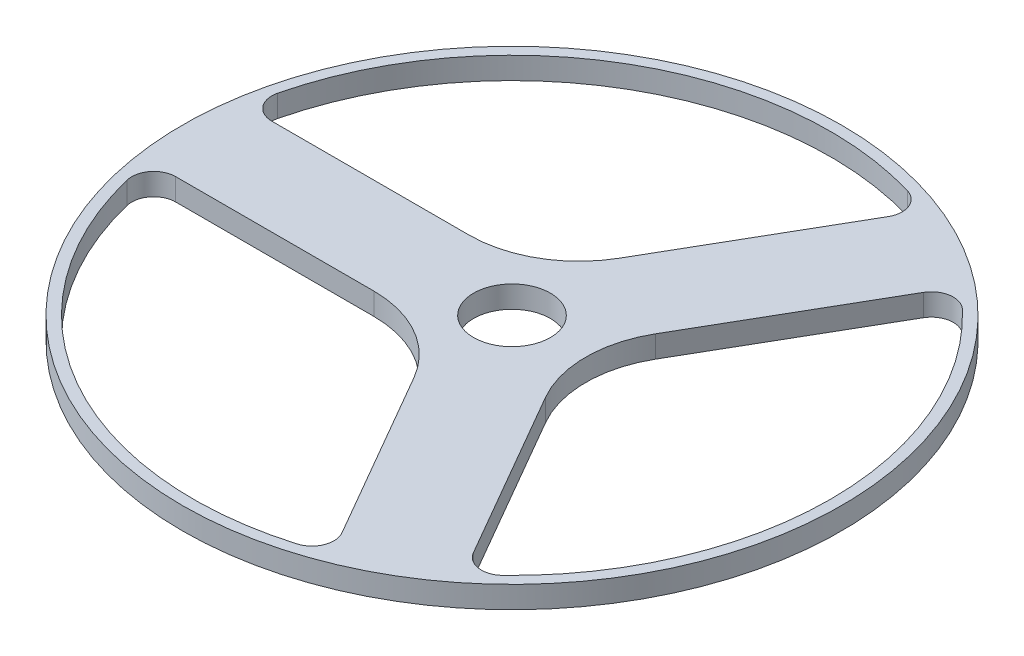
from build123d import *

# Parameters (mm, degrees)
SKETCH1_R           = 46.5
SKETCH1_R_2         = 6.5
SKETCH1_R_3         = 10
SKETCH1_R_4         = 3.5
BOSS_EXTRUDE1_DEPTH = 2
SKETCH3_R           = 5
SKETCH3_R_2         = 3.5
BOSS_EXTRUDE2_DEPTH = 100
SKETCH4_R           = 30
SKETCH4_R_2         = 5
SKETCH4_R_3         = 3.5
BOSS_EXTRUDE5_DEPTH = 2
FILLET2_R           = 2
SKETCH5_R           = 1
SKETCH5_R_2         = 3.5
CUT_EXTRUDE1_DEPTH  = 1
SKETCH6_R           = 2
CUT_EXTRUDE2_DEPTH  = 2
CHAMFER2_SIZE       = 0.8
SKETCH7_R           = 61.085714235
CUT_EXTRUDE3_DEPTH  = 122.361031637


with BuildPart() as part:
    # Sketch1 → Boss-Extrude1 (new body)
    with BuildSketch(Plane(origin=(0, 0, 0), x_dir=(1, 0, 0), z_dir=(0, 1, 0))):
        with Locations(Location((0, 0, 0), (0, 0, 270))):
            Circle(SKETCH1_R)
        with Locations(Location((0, 15, 0), (0, 0, 270))):
            Circle(SKETCH1_R_2, mode=Mode.SUBTRACT)
        with Locations(Location((-12.990381057, -7.5, 0), (0, 0, 270))):
            Circle(SKETCH1_R_3, mode=Mode.SUBTRACT)
        with Locations(Location((12.990381057, -7.5, 0), (0, 0, 270))):
            Circle(SKETCH1_R_4, mode=Mode.SUBTRACT)
        with Locations(Location((0, 0, 0), (0, 0, 270))):
            Circle(SKETCH1_R_4, mode=Mode.SUBTRACT)
    extrude(amount=BOSS_EXTRUDE1_DEPTH)

    # Sketch3 → Boss-Extrude2 (add)
    with BuildSketch(Plane(origin=(0, 2, 0), x_dir=(1, 0, 0), z_dir=(0, 1, 0))):
        with Locations(Location((0, 0, 0), (0, 0, 210))):
            Circle(SKETCH3_R)
        with Locations(Location((0, 0, 0), (0, 0, 270))):
            Circle(SKETCH3_R_2, mode=Mode.SUBTRACT)
    extrude(amount=BOSS_EXTRUDE2_DEPTH)

    # Sketch6 → Cut-Extrude2 (cut)
    with BuildSketch(Plane.XZ):
        with Locations(Location((0, 35, 0), (0, 0, 270))):
            Circle(SKETCH6_R)
        with Locations(Location((27.364101886, 21.822143065, 0), (0, 0, 270))):
            Circle(SKETCH6_R)
        with Locations(Location((34.122476926, -7.788232688, 0), (0, 0, 270))):
            Circle(SKETCH6_R)
        with Locations(Location((15.185930869, -31.533910377, 0), (0, 0, 270))):
            Circle(SKETCH6_R)
        with Locations(Location((-15.185930869, -31.533910377, 0), (0, 0, 270))):
            Circle(SKETCH6_R)
        with Locations(Location((-34.122476926, -7.788232688, 0), (0, 0, 270))):
            Circle(SKETCH6_R)
        with Locations(Location((-27.364101886, 21.822143065, 0), (0, 0, 270))):
            Circle(SKETCH6_R)
    extrude(amount=-CUT_EXTRUDE2_DEPTH, mode=Mode.SUBTRACT)

    # Chamfer2
    chamfer2_edges = [part.edges().sort_by_distance(p)[0] for p in [
        (12.990381057, 0, 4),
        (34.122476926, 0, -5.788232688),
        (27.364101886, 0, 23.822143065),
        (0, 0, 37),
        (-27.364101886, 0, 23.822143065),
        (-34.122476926, 0, -5.788232688),
        (-15.185930869, 0, -29.533910377),
        (15.185930869, 0, -29.533910377),
    ]]
    chamfer(chamfer2_edges, length=CHAMFER2_SIZE)

    # Sketch7 → Cut-Extrude3 (cut, through all)
    with BuildSketch(Plane.XZ.offset(-102)):
        Circle(SKETCH7_R)
    extrude(amount=CUT_EXTRUDE3_DEPTH, mode=Mode.SUBTRACT)


with BuildPart() as body_2:
    # Sketch4 → Boss-Extrude5 (new body)
    # profile 1 of 3: a face of its own
    with BuildSketch(Plane(origin=(0, 102, 0), x_dir=(1, 0, 0), z_dir=(0, 1, 0))):
        with Locations(Location((0, 0, 0), (0, 0, 270))):
            Circle(SKETCH4_R)
        with BuildLine():
            ThreePointArc((-28.668345883, -4.373321886), (-29, 0), (-28.668345883, 4.373321886))
            ThreePointArc((-28.668345883, 4.373321886), (-14.496121896, 25.116975335), (10.555107028, 27.010918452))
            ThreePointArc((10.555107028, 27.010918452), (14.507755353, 25.110257558), (18.128572143, 22.635257278))
            ThreePointArc((18.128572143, 22.635257278), (26.141237463, 12.555305808), (29, 0))
            ThreePointArc((29, 0), (26.156181805, -12.524142821), (18.182472179, -22.591983212))
            ThreePointArc((18.182472179, -22.591983212), (14.567551204, -25.075614687), (10.619428606, -26.985695027))
            ThreePointArc((10.619428606, -26.985695027), (-14.466191914, -25.134225501), (-28.668345883, -4.373321886))
        make_face(mode=Mode.SUBTRACT)
    # profile 2 of 3: a face of its own
    with BuildSketch(Plane(origin=(0, 102, 0), x_dir=(1, 0, 0), z_dir=(0, 1, 0))):
        with BuildLine():
            ThreePointArc((0.372035902, 9.373321886), (-3.288218135, 5.713067848), (-8.288218135, 4.373321886))
            Line((-8.288218135, 4.373321886), (-28.668345883, 4.373321886))
            ThreePointArc((-28.668345883, 4.373321886), (-29, 0), (-28.668345883, -4.373321886))
            Line((-28.668345883, -4.373321886), (-8.209333805, -4.373321886))
            ThreePointArc((-8.209333805, -4.373321886), (-3.209333805, -5.713067848), (0.450920232, -9.373321886))
            Line((0.450920232, -9.373321886), (10.619428606, -26.985695027))
            ThreePointArc((10.619428606, -26.985695027), (14.567551204, -25.075614687), (18.182472179, -22.591983212))
            Line((18.182472179, -22.591983212), (7.986293771, -4.931684166))
            ThreePointArc((7.986293771, -4.931684166), (6.646547809, 0.068315834), (7.986293771, 5.068315834))
            Line((7.986293771, 5.068315834), (18.128572143, 22.635257278))
            ThreePointArc((18.128572143, 22.635257278), (14.507755353, 25.110257558), (10.555107028, 27.010918452))
            Line((10.555107028, 27.010918452), (0.372035902, 9.373321886))
        make_face()
        with Locations(Location((0, 0, 0), (0, 0, 210))):
            Circle(SKETCH4_R_2, mode=Mode.SUBTRACT)
    # profile 3 of 3: a face of its own
    with BuildSketch(Plane(origin=(0, 102, 0), x_dir=(1, 0, 0), z_dir=(0, 1, 0))):
        with Locations(Location((0, 0, 0), (0, 0, 210))):
            Circle(SKETCH4_R_2)
        with Locations(Location((0, 0, 0), (0, 0, 270))):
            Circle(SKETCH4_R_3, mode=Mode.SUBTRACT)
    extrude(amount=BOSS_EXTRUDE5_DEPTH)

    # Fillet2
    fillet2_edges = [body_2.edges().sort_by_distance(p)[0] for p in [
        (10.555107028, 103, -27.010918452),
        (-28.668345883, 103, -4.373321886),
        (18.128572143, 103, -22.635257278),
        (18.182472179, 103, 22.591983212),
        (10.619428606, 103, 26.985695027),
        (-28.668345883, 103, 4.373321886),
    ]]
    fillet(fillet2_edges, radius=FILLET2_R)

    # Sketch5 → Cut-Extrude1 (cut)
    with BuildSketch(Plane.XZ.offset(-102)):
        with Locations(Location((-15, 0, 0), (0, 0, 270))):
            Circle(SKETCH5_R)
        with Locations(Location((7.5, 12.990381057, 0), (0, 0, 270))):
            Circle(SKETCH5_R_2)
        Polygon((8.383974596, -16.52146997), (4.883974596, -10.459292144), (6.616025404, -9.459292144), (10.116025404, -15.52146997), align=None)
    extrude(amount=-CUT_EXTRUDE1_DEPTH, mode=Mode.SUBTRACT)


solid = body_2.part
